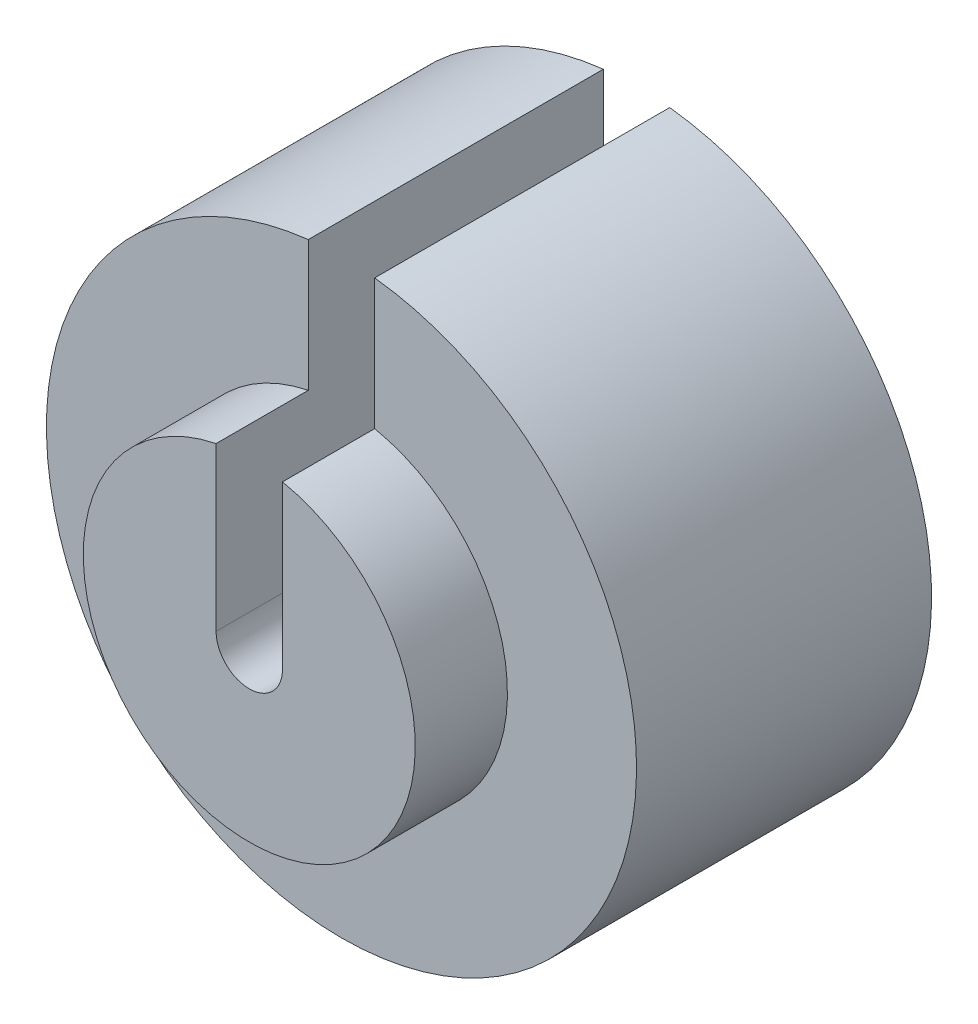
from build123d import *

# Parameters (mm, degrees)
SKETCH1_R           = 0.4
BOSS_EXTRUDE1_DEPTH = 0.4
SKETCH2_R           = 0.225
BOSS_EXTRUDE2_DEPTH = 0.525
SKETCH3_R           = 0.045
CUT_EXTRUDE1_DEPTH  = 1.771767452
SKETCH5_W           = 0.09
SKETCH5_H           = 0.5
CUT_EXTRUDE2_DEPTH  = 1.771767452


with BuildPart() as part:
    # Sketch1 → Boss-Extrude1 (new body)
    with BuildSketch(Plane.XY):
        Circle(SKETCH1_R)
    extrude(amount=BOSS_EXTRUDE1_DEPTH)

    # Sketch2 → Boss-Extrude2 (add)
    with BuildSketch(Plane(origin=(0, 0, 0), x_dir=(-1, 0, 0), z_dir=(0, 0, -1))):
        Circle(SKETCH2_R)
    extrude(amount=-BOSS_EXTRUDE2_DEPTH)

    # Sketch3 → Cut-Extrude1 (cut, through all)
    with BuildSketch(Plane.XY):
        Circle(SKETCH3_R)
    extrude(amount=CUT_EXTRUDE1_DEPTH, mode=Mode.SUBTRACT)

    # Sketch5 → Cut-Extrude2 (cut, through all)
    with BuildSketch(Plane(origin=(0, 0, 0), x_dir=(-1, 0, 0), z_dir=(0, 0, -1))):
        with Locations((0, 0.25)):
            Rectangle(SKETCH5_W, SKETCH5_H)
    extrude(amount=-CUT_EXTRUDE2_DEPTH, mode=Mode.SUBTRACT)


solid = part.part
